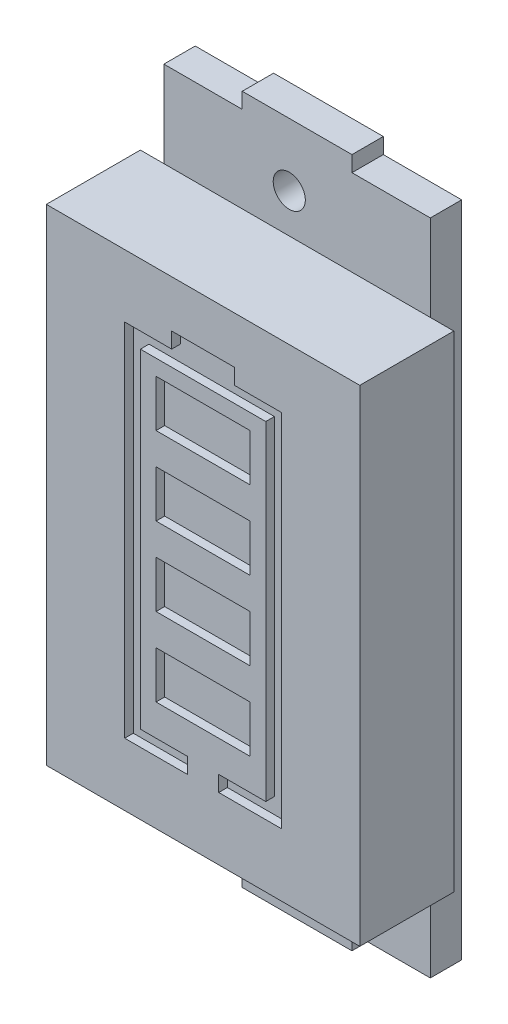
from build123d import *

# Parameters (mm, degrees)
BOSS_EXTRUDE1_DEPTH                     = 2
SKETCH2_W                               = 20
SKETCH2_H                               = 31
BOSS_EXTRUDE2_DEPTH                     = 6
SKETCH3_W                               = 6
SKETCH3_H                               = 3
CUT_EXTRUDE1_DEPTH                      = 0.55
SKETCH6_W                               = 1.025
SKETCH6_H                               = 8
TAP_DRILL_FOR_M2_5X0_45_TAP1_AT_2_COUNT = 2
TAP_DRILL_FOR_M2_5X0_45_TAP1_AT_2_PITCH = 36


with BuildPart() as part:
    # Sketch1 → Boss-Extrude1 (new body)
    with BuildSketch(Plane.XY):
        Polygon((-3.5, 22), (3.5, 22), (3.5, 21), (8.5, 21), (8.5, -21), (3.5, -21), (3.5, -22), (-3.5, -22), (-3.5, -21), (-8.5, -21), (-8.5, 21), (-3.5, 21), align=None)
    extrude(amount=BOSS_EXTRUDE1_DEPTH)

    # Sketch6 → Tap Drill for M2.5x0.45 Tap1 (revolve, cut)
    with BuildSketch(Plane(origin=(-0.5, 18, 0), x_dir=(0, 1, 0), z_dir=(1, 0, 0))):
        with Locations((0.5125, 4)):
            Rectangle(SKETCH6_W, SKETCH6_H)
    tap_drill_for_m2_5x0_45_tap1 = revolve(axis=Axis((-0.5, 18, -6.35), (0, 0, 1)), mode=Mode.SUBTRACT)

    # Tap Drill for M2.5x0.45 Tap1 at 2: Tap Drill for M2.5x0.45 Tap1 ×2
    with Locations(*[(0, -i * TAP_DRILL_FOR_M2_5X0_45_TAP1_AT_2_PITCH, 0) for i in range(1, TAP_DRILL_FOR_M2_5X0_45_TAP1_AT_2_COUNT)]):
        add(tap_drill_for_m2_5x0_45_tap1, mode=Mode.SUBTRACT)


with BuildPart() as body_2:
    # Sketch2 → Boss-Extrude2 (new body)
    with BuildSketch(Plane.XY.offset(2)):
        Rectangle(SKETCH2_W, SKETCH2_H)
    extrude(amount=BOSS_EXTRUDE2_DEPTH)

    # Sketch3 → Cut-Extrude1 (cut)
    with BuildSketch(Plane.XY.offset(8)):
        Polygon((-1, -11.5), (-5, -11.5), (-5, 11.5), (-2, 11.5), (-2, 12.5), (2, 12.5), (2, 11.5), (5, 11.5), (5, -11.5), (1, -11.5), (1, -10.5), (4, -10.5), (4, 10.5), (-4, 10.5), (-4, -10.5), (-1, -10.5), align=None)
        with Locations((0, -2)):
            Rectangle(SKETCH3_W, SKETCH3_H)
        with Locations((0, -7)):
            Rectangle(SKETCH3_W, SKETCH3_H)
        with Locations((0, 3)):
            Rectangle(SKETCH3_W, SKETCH3_H)
        with Locations((0, 8)):
            Rectangle(SKETCH3_W, SKETCH3_H)
    extrude(amount=-CUT_EXTRUDE1_DEPTH, mode=Mode.SUBTRACT)


solid = Compound([part.part, body_2.part])
